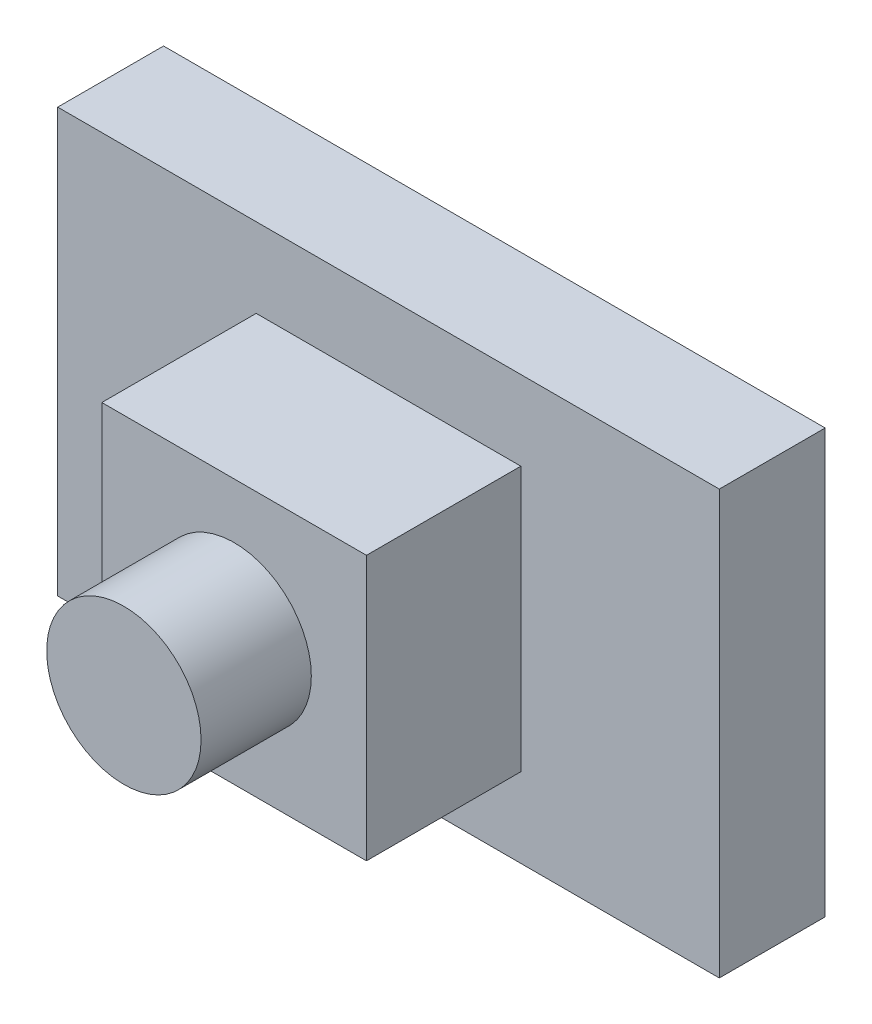
from build123d import *

# Parameters (mm, degrees)
IZIM2_W                     = 15
IZIM2_H                     = 9.6
Y_KSEKLIK_EKSTR_ZYON1_DEPTH = 2.4
IZIM3_W                     = 6
IZIM3_H                     = 6
Y_KSEKLIK_EKSTR_ZYON2_DEPTH = 3.5
IZIM4_R                     = 1.75
Y_KSEKLIK_EKSTR_ZYON3_DEPTH = 2.5


with BuildPart() as part:
    # Çizim2 → Yükseklik-Ekstrüzyon1 (new body)
    with BuildSketch(Plane.XY):
        Rectangle(IZIM2_W, IZIM2_H)
    extrude(amount=Y_KSEKLIK_EKSTR_ZYON1_DEPTH)

    # Çizim3 → Yükseklik-Ekstrüzyon2 (add)
    with BuildSketch(Plane.XY.offset(2.4)):
        Rectangle(IZIM3_W, IZIM3_H)
    extrude(amount=Y_KSEKLIK_EKSTR_ZYON2_DEPTH)

    # Çizim4 → Yükseklik-Ekstrüzyon3 (add)
    with BuildSketch(Plane.XY.offset(5.9)):
        Circle(IZIM4_R)
    extrude(amount=Y_KSEKLIK_EKSTR_ZYON3_DEPTH)


solid = part.part
